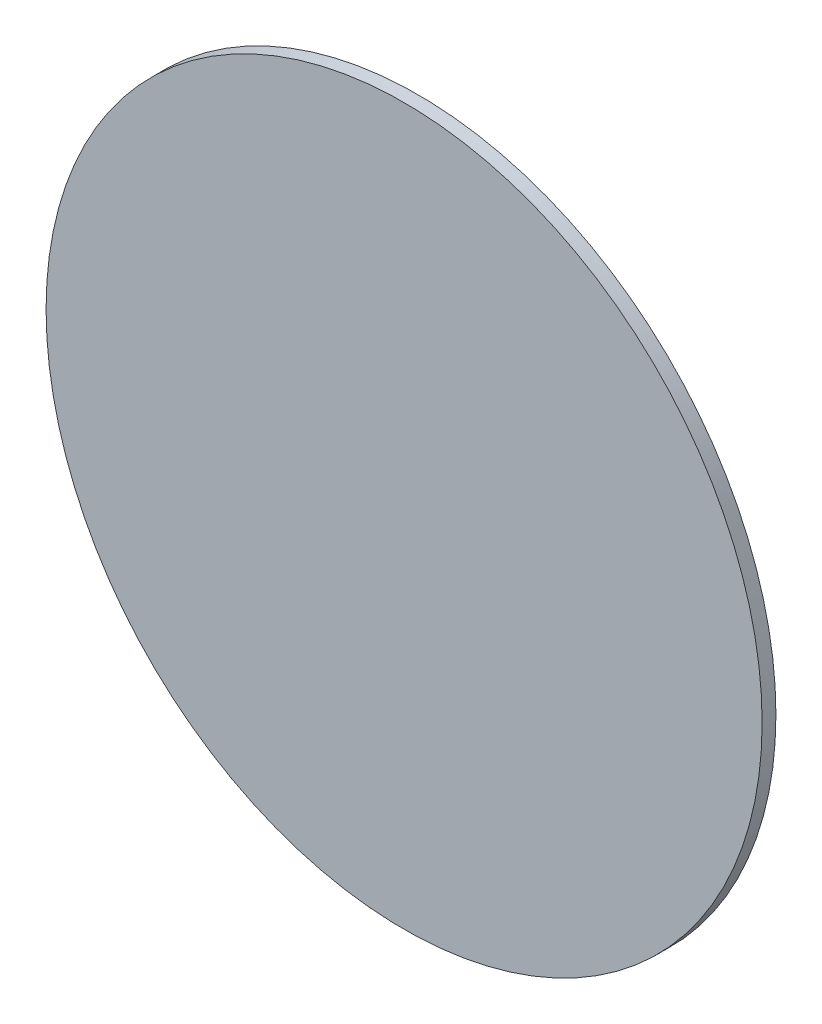
from build123d import *

# Parameters (mm, degrees)
SKETCH1_R           = 82.5
BOSS_EXTRUDE1_DEPTH = 3.175


with BuildPart() as part:
    # Sketch1 → Boss-Extrude1 (new body)
    with BuildSketch(Plane.XY):
        Circle(SKETCH1_R)
    extrude(amount=BOSS_EXTRUDE1_DEPTH)


solid = part.part
